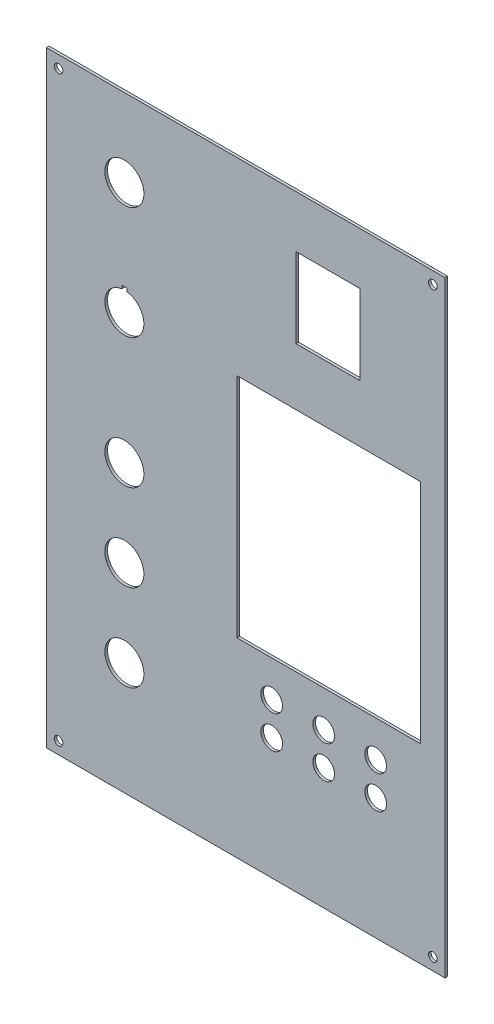
from build123d import *

# Parameters (mm, degrees)
ESQUISSE1_W             = 230
ESQUISSE1_H             = 350
BASE_EXTRUSION_DEPTH    = 1.5
ESQUISSE2_R             = 2.5
ENL_V_MAT_EXTRU_1_DEPTH = 1.5
ESQUISSE3_R             = 11.25
ENL_V_MAT_EXTRU_2_DEPTH = 1.5
ESQUISSE4_R             = 6.25
ENL_V_MAT_EXTRU_3_DEPTH = 1.5
ESQUISSE5_W             = 106
ESQUISSE5_H             = 131
ENL_V_MAT_EXTRU_4_DEPTH = 1.5
ESQUISSE6_W             = 37
ESQUISSE6_H             = 46
ENL_V_MAT_EXTRU_5_DEPTH = 1.5


with BuildPart() as part:
    # Esquisse1 → Base-Extrusion (new body)
    with BuildSketch(Plane.XY):
        with Locations((115, 175)):
            Rectangle(ESQUISSE1_W, ESQUISSE1_H)
    extrude(amount=BASE_EXTRUSION_DEPTH)

    # Esquisse2 → Enlèv. mat.-Extru.1 (cut)
    with BuildSketch(Plane.XY.offset(1.5)):
        with Locations((7, 7)):
            Circle(ESQUISSE2_R)
        with Locations((223, 7)):
            Circle(ESQUISSE2_R)
        with Locations((7, 343)):
            Circle(ESQUISSE2_R)
        with Locations((223, 343)):
            Circle(ESQUISSE2_R)
    extrude(amount=-ENL_V_MAT_EXTRU_1_DEPTH, mode=Mode.SUBTRACT)

    # Esquisse3 → Enlèv. mat.-Extru.2 (cut)
    with BuildSketch(Plane.XY.offset(1.5)):
        with Locations((45, 65)):
            Circle(ESQUISSE3_R)
        with Locations((45, 115)):
            Circle(ESQUISSE3_R)
        with Locations((45, 165)):
            Circle(ESQUISSE3_R)
        with Locations((45, 305)):
            Circle(ESQUISSE3_R)
        with BuildLine():
            Line((43.5, 251.14955156), (43.5, 253))
            Line((43.5, 253), (46.5, 253))
            Line((46.5, 253), (46.5, 251.14955156))
            ThreePointArc((46.5, 251.14955156), (45, 228.75), (43.5, 251.14955156))
        make_face()
    extrude(amount=-ENL_V_MAT_EXTRU_2_DEPTH, mode=Mode.SUBTRACT)

    # Esquisse4 → Enlèv. mat.-Extru.3 (cut)
    with BuildSketch(Plane.XY.offset(1.5)):
        with Locations((130, 70)):
            Circle(ESQUISSE4_R)
        with Locations((130, 89)):
            Circle(ESQUISSE4_R)
        with Locations((160, 70)):
            Circle(ESQUISSE4_R)
        with Locations((160, 89)):
            Circle(ESQUISSE4_R)
        with Locations((190, 70)):
            Circle(ESQUISSE4_R)
        with Locations((190, 89)):
            Circle(ESQUISSE4_R)
    extrude(amount=-ENL_V_MAT_EXTRU_3_DEPTH, mode=Mode.SUBTRACT)

    # Esquisse5 → Enlèv. mat.-Extru.4 (cut)
    with BuildSketch(Plane.XY.offset(1.5)):
        with Locations((163, 175.5)):
            Rectangle(ESQUISSE5_W, ESQUISSE5_H)
    extrude(amount=-ENL_V_MAT_EXTRU_4_DEPTH, mode=Mode.SUBTRACT)

    # Esquisse6 → Enlèv. mat.-Extru.5 (cut)
    with BuildSketch(Plane.XY.offset(1.5)):
        with Locations((162.5, 297)):
            Rectangle(ESQUISSE6_W, ESQUISSE6_H)
    extrude(amount=-ENL_V_MAT_EXTRU_5_DEPTH, mode=Mode.SUBTRACT)


solid = part.part
